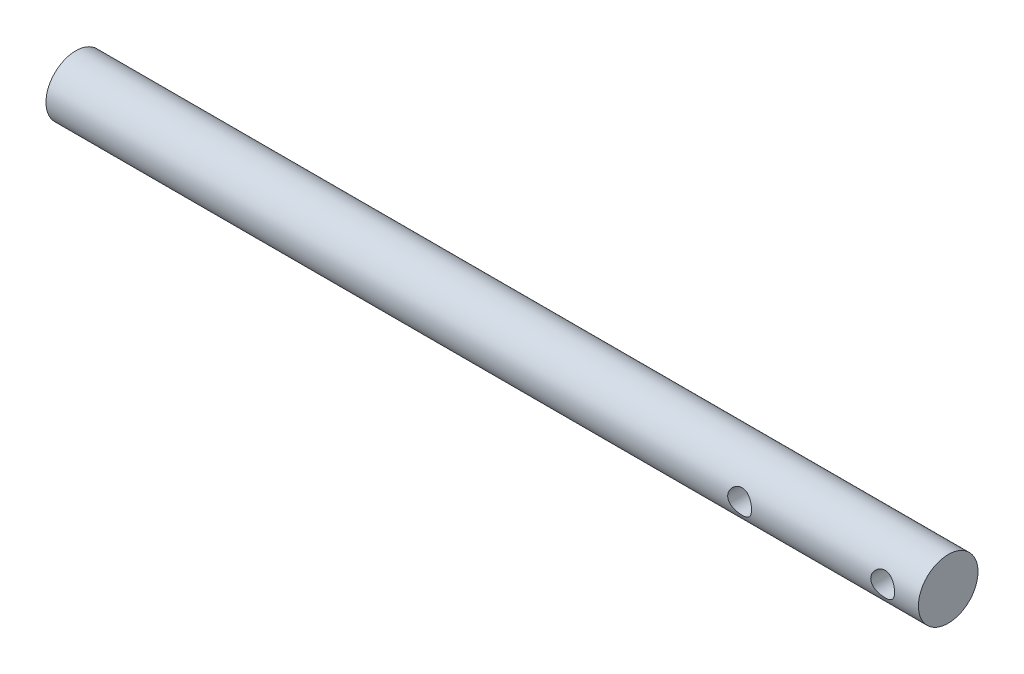
from build123d import *

# Parameters (mm, degrees)
SKETCH1_R           = 25
BOSS_EXTRUDE1_DEPTH = 366
SKETCH2_R           = 10
CUT_EXTRUDE1_DEPTH  = 160


with BuildPart() as part:
    # Sketch1 → Boss-Extrude1 (new, symmetric)
    with BuildSketch(Plane(origin=(0, 0, 0), x_dir=(0, 0, -1), z_dir=(1, 0, 0))):
        Circle(SKETCH1_R)
    extrude(amount=BOSS_EXTRUDE1_DEPTH, both=True)

    # Sketch2 → Cut-Extrude1 (cut, symmetric)
    with BuildSketch(Plane.XY):
        with Locations((336, 0)):
            Circle(SKETCH2_R)
        with Locations((216, 0)):
            Circle(SKETCH2_R)
    extrude(amount=CUT_EXTRUDE1_DEPTH, both=True, mode=Mode.SUBTRACT)


solid = part.part
